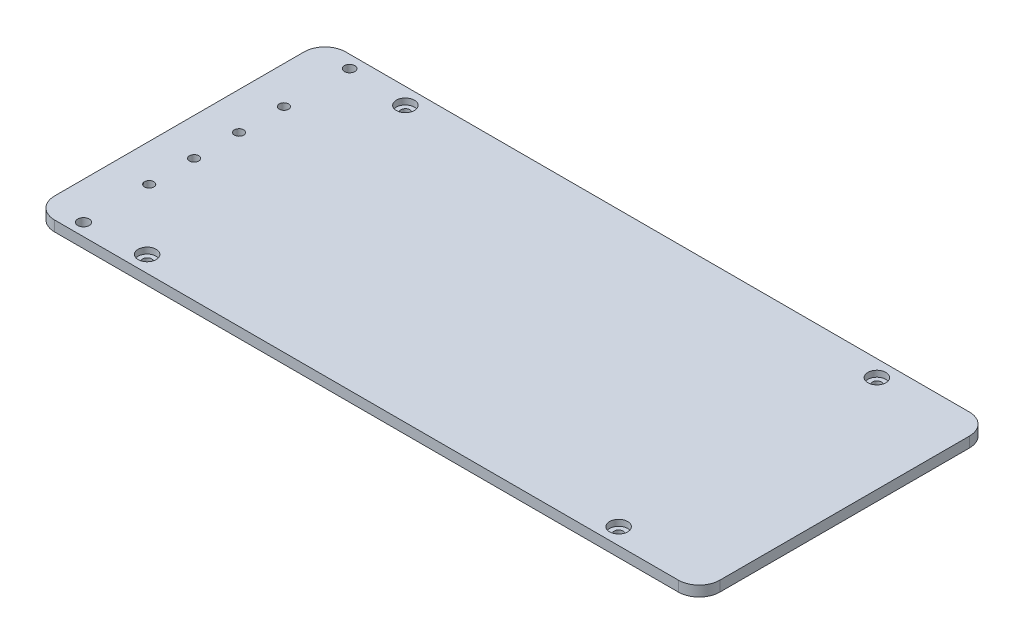
from build123d import *

# Parameters (mm, degrees)
SKETCH1_W                                        = 406.4
SKETCH1_H                                        = 177.8
BOSS_EXTRUDE1_DEPTH                              = 6.35
FILLET1_R                                        = 12.7
CBORE_FOR_M5_PAN_HEAD_MACHINE_SCREW1_D           = 5.5
CBORE_FOR_M5_PAN_HEAD_MACHINE_SCREW1_CBORE_D     = 11
CBORE_FOR_M5_PAN_HEAD_MACHINE_SCREW1_CBORE_DEPTH = 3.7
MIRROR2_COPY_1_D                                 = 5.5
MIRROR2_COPY_1_CBORE_D                           = 11
MIRROR2_COPY_1_CBORE_DEPTH                       = 3.7
SKETCH4_R                                        = 3.175
SKETCH4_R_2                                      = 3.4925
CUT_EXTRUDE1_DEPTH                               = 222.886846163
SKETCH5_R                                        = 2.836407304
CUT_EXTRUDE2_DEPTH                               = 222.886846163


with BuildPart() as part:
    # Sketch1 → Boss-Extrude1 (new body)
    with BuildSketch(Plane(origin=(0, 0, 0), x_dir=(1, 0, 0), z_dir=(0, 1, 0))):
        Rectangle(SKETCH1_W, SKETCH1_H)
    extrude(amount=BOSS_EXTRUDE1_DEPTH)

    # Fillet1
    fillet1_edges = [part.edges().sort_by_distance(p)[0] for p in [
        (-203.2, 3.175, -88.9),
        (-203.2, 3.175, 88.9),
        (203.2, 3.175, 88.9),
        (203.2, 3.175, -88.9),
    ]]
    fillet(fillet1_edges, radius=FILLET1_R)

    # CBORE for M5 Pan Head Machine Screw1 (through all)
    with Locations(Plane(origin=(0, 6.35, 0), x_dir=(1, 0, 0), z_dir=(0, 1, 0))):
        with Locations((-143.999769965, -78.864619027)):
            cbore_for_m5_pan_head_machine_screw1 = CounterBoreHole(CBORE_FOR_M5_PAN_HEAD_MACHINE_SCREW1_D / 2, CBORE_FOR_M5_PAN_HEAD_MACHINE_SCREW1_CBORE_D / 2, CBORE_FOR_M5_PAN_HEAD_MACHINE_SCREW1_CBORE_DEPTH)

    # Mirror1: CBORE for M5 Pan Head Machine Screw1 across plane
    add(cbore_for_m5_pan_head_machine_screw1.mirror(Plane(origin=(0, 0, 0), x_dir=(0, 0, 1), z_dir=(1, 0, 0))), mode=Mode.SUBTRACT)

    # Mirror2: CBORE for M5 Pan Head Machine Screw1 across plane
    add(cbore_for_m5_pan_head_machine_screw1.mirror(Plane.XY), mode=Mode.SUBTRACT)

    # Mirror2 copy 1 (through all)
    with Locations(Plane(origin=(0, 6.35, 0), x_dir=(-1, 0, 0), z_dir=(0, 1, 0))):
        with Locations((-143.999769965, -78.864619027)):
            CounterBoreHole(MIRROR2_COPY_1_D / 2, MIRROR2_COPY_1_CBORE_D / 2, MIRROR2_COPY_1_CBORE_DEPTH)

    # Sketch4 → Cut-Extrude1 (cut, through all)
    with BuildSketch(Plane(origin=(0, 6.35, 0), x_dir=(1, 0, 0), z_dir=(0, 1, 0))):
        with Locations(Location((-180.445833333, 81.28, 0), (0, 0, 270))):
            Circle(SKETCH4_R)
        with Locations(Location((-180.445833333, -81.28, 0), (0, 0, 270))):
            Circle(SKETCH4_R_2)
    extrude(amount=-CUT_EXTRUDE1_DEPTH, mode=Mode.SUBTRACT)

    # Sketch5 → Cut-Extrude2 (cut, through all)
    with BuildSketch(Plane(origin=(0, 6.35, 0), x_dir=(1, 0, 0), z_dir=(0, 1, 0))):
        with Locations(Location((-180.445833333, 41.148, 0), (0, 0, 270))):
            Circle(SKETCH5_R)
        with Locations(Location((-180.445833333, 13.716, 0), (0, 0, 270))):
            Circle(SKETCH5_R)
        with Locations(Location((-180.445833333, -13.716, 0), (0, 0, 270))):
            Circle(SKETCH5_R)
        with Locations(Location((-180.445833333, -41.148, 0), (0, 0, 270))):
            Circle(SKETCH5_R)
    extrude(amount=-CUT_EXTRUDE2_DEPTH, mode=Mode.SUBTRACT)


solid = part.part
